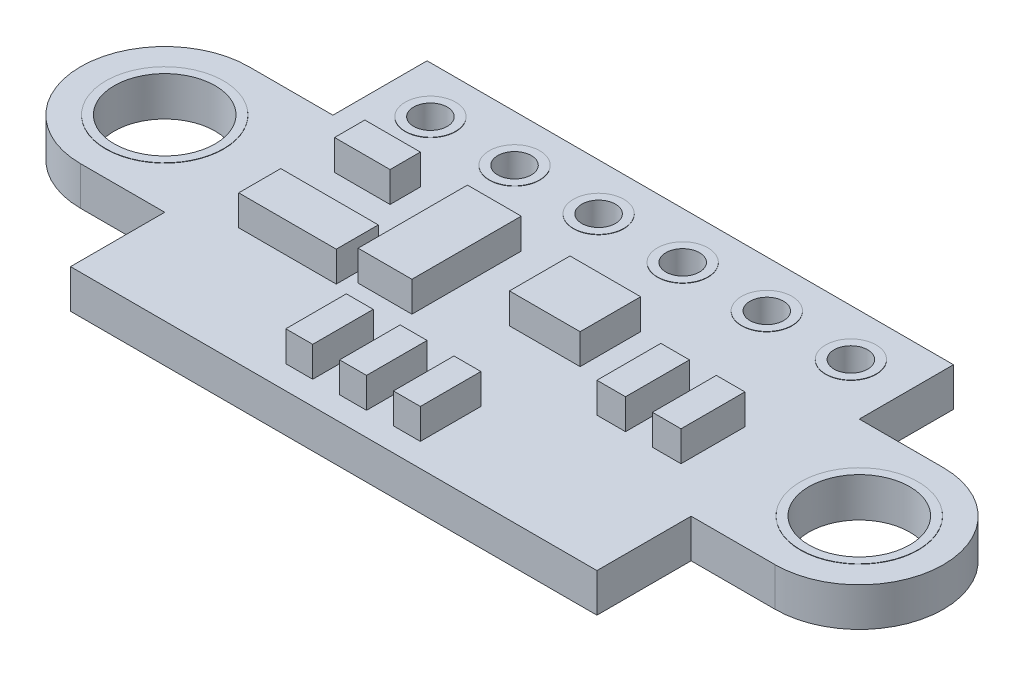
from build123d import *

# Parameters (mm, degrees)
SKETCH1_R               = 1.5
PCB_DEPTH               = 1.15
SKETCH2_R               = 0.5
INITIAL_HOLE_DEPTH      = 14.92455116
PIN_HOLE_LPATTERN_COUNT = 6
PIN_HOLE_LPATTERN_PITCH = 2.5
SKETCH4_W               = 4.4
SKETCH4_H               = 2.4
BOTTOM_COMPONENT_DEPTH  = 0.7
SKETCH3_W               = 0.8
SKETCH3_H               = 1.8
SKETCH3_W_2             = 1.65
SKETCH3_H_2             = 0.9
TAN_COMPONENTS_DEPTH    = 0.9
SKETCH3_3_W             = 2.1
SKETCH3_3_H             = 1.8
SKETCH3_3_W_2           = 1.6
SKETCH3_3_H_2           = 3.25
SKETCH3_3_W_3           = 2.9
SKETCH3_3_H_3           = 1.25
SKETCH3_3_W_4           = 0.85
SKETCH3_3_H_4           = 1.9
BLACK_COMPONENTS_DEPTH  = 0.9
GOLD_START              = -1.16
SKETCH5_R               = 0.75
SKETCH5_R_2             = 0.5
SKETCH5_R_3             = 1.75
SKETCH5_R_4             = 1.5
GOLD_CONTACTS_DEPTH     = 1.17
SILKSCREEN_DEPTH        = 0.01


with BuildPart() as part:
    # Sketch1 → PCB (new body)
    with BuildSketch(Plane(origin=(0, 0, 0), x_dir=(1, 0, 0), z_dir=(0, 1, 0))):
        with BuildLine():
            Line((-7.825, -5.3), (7.825, -5.3))
            Line((7.825, -5.3), (7.825, -2.5))
            Line((7.825, -2.5), (10.325, -2.5))
            ThreePointArc((10.325, -2.5), (12.825, 0), (10.325, 2.5))
            Line((10.325, 2.5), (7.825, 2.5))
            Line((7.825, 2.5), (7.825, 5.3))
            Line((7.825, 5.3), (-7.825, 5.3))
            Line((-7.825, 5.3), (-7.825, 2.5))
            Line((-7.825, 2.5), (-10.325, 2.5))
            ThreePointArc((-10.325, 2.5), (-12.825, 0), (-10.325, -2.5))
            Line((-10.325, -2.5), (-7.825, -2.5))
            Line((-7.825, -2.5), (-7.825, -5.3))
        make_face()
        with Locations(Location((-10.325, 0, 0), (0, 0, 270))):
            Circle(SKETCH1_R, mode=Mode.SUBTRACT)
        with Locations(Location((10.325, 0, 0), (0, 0, 270))):
            Circle(SKETCH1_R, mode=Mode.SUBTRACT)
    extrude(amount=PCB_DEPTH)

    # Sketch2 → Initial Hole (cut, through all)
    with BuildSketch(Plane(origin=(0, 1.15, 0), x_dir=(1, 0, 0), z_dir=(0, 1, 0))):
        with Locations(Location((-6.325, 3.9, 0), (0, 0, 270))):
            Circle(SKETCH2_R)
    initial_hole = extrude(amount=-INITIAL_HOLE_DEPTH, mode=Mode.SUBTRACT)

    # Pin Hole LPattern: Initial Hole ×6
    with Locations(*[(i * PIN_HOLE_LPATTERN_PITCH, 0, 0) for i in range(1, PIN_HOLE_LPATTERN_COUNT)]):
        add(initial_hole, mode=Mode.SUBTRACT)

    # Sketch4 → Bottom Component (add)
    with BuildSketch(Plane.XZ):
        with Locations((-0.125, 2.5)):
            Rectangle(SKETCH4_W, SKETCH4_H)
    extrude(amount=BOTTOM_COMPONENT_DEPTH)

    # Sketch3 → Tan Components (add)
    with BuildSketch(Plane(origin=(0, 1.15, 0), x_dir=(1, 0, 0), z_dir=(0, 1, 0))):
        with Locations((-1.725, -3.7)):
            Rectangle(SKETCH3_W, SKETCH3_H)
        with Locations((-0.125, -3.7)):
            Rectangle(SKETCH3_W, SKETCH3_H)
        with Locations((1.475, -3.7)):
            Rectangle(SKETCH3_W, SKETCH3_H)
        with Locations((-5.5, 1.5)):
            Rectangle(SKETCH3_W_2, SKETCH3_H_2)
    extrude(amount=TAN_COMPONENTS_DEPTH)

    # Sketch3<3> → Black Components (add)
    with BuildSketch(Plane(origin=(0, 1.15, 0), x_dir=(1, 0, 0), z_dir=(0, 1, 0))):
        with Locations((1.275, 0.6)):
            Rectangle(SKETCH3_3_W, SKETCH3_3_H)
        with Locations((-2.325, 0.175)):
            Rectangle(SKETCH3_3_W_2, SKETCH3_3_H_2)
        with Locations((-4.875, -1.175)):
            Rectangle(SKETCH3_3_W_3, SKETCH3_3_H_3)
        with Locations((4.25, -0.35)):
            Rectangle(SKETCH3_3_W_4, SKETCH3_3_H_4)
        with Locations((5.9, -0.35)):
            Rectangle(SKETCH3_3_W_4, SKETCH3_3_H_4)
    extrude(amount=BLACK_COMPONENTS_DEPTH)

    # Sketch5 → Gold Contacts (add)
    # profile 1 of 8: a face of its own
    with BuildSketch(Plane(origin=(0, 1.15, 0), x_dir=(1, 0, 0), z_dir=(0, 1, 0)).offset(GOLD_START)):
        with Locations(Location((-6.325, 3.9, 0), (0, 0, 90))):
            Circle(SKETCH5_R)
        with Locations(Location((-6.325, 3.9, 0), (0, 0, 270))):
            Circle(SKETCH5_R_2, mode=Mode.SUBTRACT)
    # profile 2 of 8: a face of its own
    with BuildSketch(Plane(origin=(0, 1.15, 0), x_dir=(1, 0, 0), z_dir=(0, 1, 0)).offset(GOLD_START)):
        with Locations(Location((-3.825, 3.9, 0), (0, 0, 90))):
            Circle(SKETCH5_R)
        with Locations(Location((-3.825, 3.9, 0), (0, 0, 270))):
            Circle(SKETCH5_R_2, mode=Mode.SUBTRACT)
    # profile 3 of 8: a face of its own
    with BuildSketch(Plane(origin=(0, 1.15, 0), x_dir=(1, 0, 0), z_dir=(0, 1, 0)).offset(GOLD_START)):
        with Locations(Location((-1.325, 3.9, 0), (0, 0, 90))):
            Circle(SKETCH5_R)
        with Locations(Location((-1.325, 3.9, 0), (0, 0, 270))):
            Circle(SKETCH5_R_2, mode=Mode.SUBTRACT)
    # profile 4 of 8: a face of its own
    with BuildSketch(Plane(origin=(0, 1.15, 0), x_dir=(1, 0, 0), z_dir=(0, 1, 0)).offset(GOLD_START)):
        with Locations(Location((1.175, 3.9, 0), (0, 0, 90))):
            Circle(SKETCH5_R)
        with Locations(Location((1.175, 3.9, 0), (0, 0, 270))):
            Circle(SKETCH5_R_2, mode=Mode.SUBTRACT)
    # profile 5 of 8: a face of its own
    with BuildSketch(Plane(origin=(0, 1.15, 0), x_dir=(1, 0, 0), z_dir=(0, 1, 0)).offset(GOLD_START)):
        with Locations(Location((3.675, 3.9, 0), (0, 0, 90))):
            Circle(SKETCH5_R)
        with Locations(Location((3.675, 3.9, 0), (0, 0, 270))):
            Circle(SKETCH5_R_2, mode=Mode.SUBTRACT)
    # profile 6 of 8: a face of its own
    with BuildSketch(Plane(origin=(0, 1.15, 0), x_dir=(1, 0, 0), z_dir=(0, 1, 0)).offset(GOLD_START)):
        with Locations(Location((6.175, 3.9, 0), (0, 0, 90))):
            Circle(SKETCH5_R)
        with Locations(Location((6.175, 3.9, 0), (0, 0, 270))):
            Circle(SKETCH5_R_2, mode=Mode.SUBTRACT)
    # profile 7 of 8: a face of its own
    with BuildSketch(Plane(origin=(0, 1.15, 0), x_dir=(1, 0, 0), z_dir=(0, 1, 0)).offset(GOLD_START)):
        with Locations(Location((-10.325, 0, 0), (0, 0, 90))):
            Circle(SKETCH5_R_3)
        with Locations(Location((-10.325, 0, 0), (0, 0, 90))):
            Circle(SKETCH5_R_4, mode=Mode.SUBTRACT)
    # profile 8 of 8: a face of its own
    with BuildSketch(Plane(origin=(0, 1.15, 0), x_dir=(1, 0, 0), z_dir=(0, 1, 0)).offset(GOLD_START)):
        with Locations(Location((10.325, 0, 0), (0, 0, 90))):
            Circle(SKETCH5_R_3)
        with Locations(Location((10.325, 0, 0), (0, 0, 90))):
            Circle(SKETCH5_R_4, mode=Mode.SUBTRACT)
    extrude(amount=GOLD_CONTACTS_DEPTH)

    # Sketch6 → Silkscreen (add)
    # profile 1 of 22: a face of its own
    with BuildSketch(Plane.XZ):
        Polygon((-6.825, -1.952173913), (-5.825, -2.287771739), (-5.825, -2.471195652), (-6.825, -2.807246377), (-6.825, -2.653713768), (-6.151086957, -2.43451087), (-5.953623188, -2.372463768), (-6.151086957, -2.310643116), (-6.825, -2.097327899), align=None)
    # profile 2 of 22: a face of its own
    with BuildSketch(Plane.XZ):
        Polygon((-6.709057971, -1.582608696), (-6.709057971, -1.814492754), (-6.825, -1.814492754), (-6.825, -1.205797101), (-6.709057971, -1.205797101), (-6.709057971, -1.437681159), (-5.940942029, -1.437681159), (-5.940942029, -1.205797101), (-5.825, -1.205797101), (-5.825, -1.814492754), (-5.940942029, -1.814492754), (-5.940942029, -1.582608696), align=None)
    # profile 3 of 22: a face of its own
    with BuildSketch(Plane.XZ):
        Polygon((-5.825, -0.32173913), (-5.825, -0.513088768), (-6.450226449, -0.780751812), (-6.651086957, -0.857971014), (-6.145652174, -0.857971014), (-5.825, -0.857971014), (-5.825, -1.002898551), (-6.825, -1.002898551), (-6.825, -0.813813406), (-6.229438406, -0.558831522), (-5.998913043, -0.466666667), (-6.538768116, -0.466666667), (-6.825, -0.466666667), (-6.825, -0.32173913), align=None)
    # profile 4 of 22: a face of its own
    with BuildSketch(Plane.XZ):
        with BuildLine():
            add(Edge.make_bspline(
                [(-4.16557971, -2.017391304), (-4.174136808, -2.036630775), (-4.191199813, -2.074994622), (-4.206514485, -2.125407709), (-4.215359186, -2.166891843), (-4.220047282, -2.199419822), (-4.223108769, -2.233289439), (-4.22340197, -2.25636393), (-4.223550725, -2.268070652)],
                knots=[0, 0, 0, 0, 1.45945927, 2.910187841, 3.643322816, 4.400006487, 5.188251666, 6, 6, 6, 6], degree=3))
            add(Edge.make_bspline(
                [(-4.223550725, -2.268070652), (-4.22322949, -2.281377316), (-4.222602438, -2.307351996), (-4.216940861, -2.345108655), (-4.208337016, -2.380758222), (-4.195489198, -2.413866615), (-4.17961186, -2.44462082), (-4.160629453, -2.472899107), (-4.138904749, -2.498868644), (-4.113944215, -2.522077592), (-4.086253856, -2.542779138), (-4.055632763, -2.560551871), (-4.022719242, -2.576378917), (-3.987082881, -2.589094015), (-3.949265216, -2.599443979), (-3.909263191, -2.606099476), (-3.867467195, -2.611013366), (-3.838904478, -2.611397876), (-3.824320652, -2.611594203)],
                knots=[0, 0, 0, 0, 1.073506903, 2.095491357, 3.07528147, 4.02808022, 4.954664346, 5.863855779, 6.771964439, 7.68156413, 8.60894928, 9.556766833, 10.535210833, 11.552936014, 12.60679191, 13.695699548, 14.823448183, 16, 16, 16, 16], degree=3))
            add(Edge.make_bspline(
                [(-3.824320652, -2.611594203), (-3.809143177, -2.611380344), (-3.779578644, -2.610963765), (-3.736449664, -2.607633153), (-3.695878247, -2.601633568), (-3.657629955, -2.593961819), (-3.622081106, -2.583343084), (-3.589249985, -2.570170376), (-3.55912608, -2.554625403), (-3.531963675, -2.536090261), (-3.507539876, -2.515047996), (-3.486319521, -2.490985639), (-3.468092374, -2.464275607), (-3.452820225, -2.434812166), (-3.44069766, -2.402464295), (-3.432593727, -2.36704555), (-3.427130416, -2.328777955), (-3.426681667, -2.302209832), (-3.426449275, -2.288451087)],
                knots=[0, 0, 0, 0, 1.243083075, 2.421428388, 3.539723701, 4.600698439, 5.613925084, 6.573719655, 7.494592113, 8.384583086, 9.261071518, 10.128265192, 11.004557353, 11.903267233, 12.840351451, 13.825576228, 14.873938418, 16, 16, 16, 16], degree=3))
            add(Edge.make_bspline(
                [(-3.426449275, -2.288451087), (-3.426557797, -2.283391816), (-3.426783167, -2.272885048), (-3.427977385, -2.256723311), (-3.429688391, -2.240016095), (-3.432332267, -2.223210614), (-3.434998211, -2.206580775), (-3.439049004, -2.190736952), (-3.442817527, -2.175890096), (-3.446156732, -2.1666755), (-3.447735507, -2.162318841)],
                knots=[0, 0, 0, 0, 0.945174182, 1.962876632, 3.026435683, 4.081359978, 5.140798144, 6.170252855, 7.134895744, 8, 8, 8, 8], degree=3))
            Line((-3.447735507, -2.162318841), (-3.774275362, -2.162318841))
            Line((-3.774275362, -2.162318841), (-3.774275362, -2.363405797))
            Line((-3.774275362, -2.363405797), (-3.890217391, -2.363405797))
            Line((-3.890217391, -2.363405797), (-3.890217391, -2.017391304))
            Line((-3.890217391, -2.017391304), (-3.371875, -2.017391304))
            add(Edge.make_bspline(
                [(-3.371875, -2.017391304), (-3.367030046, -2.028271125), (-3.357200328, -2.050344726), (-3.345363234, -2.08510047), (-3.334241057, -2.120769039), (-3.325959411, -2.157567213), (-3.31869163, -2.19443818), (-3.31419718, -2.231229109), (-3.310988457, -2.267183443), (-3.310665771, -2.290859659), (-3.310507246, -2.302490942)],
                knots=[0, 0, 0, 0, 0.972500234, 1.973063936, 2.997292887, 4.023432248, 5.052698482, 6.066196364, 7.049990992, 8, 8, 8, 8], degree=3))
            add(Edge.make_bspline(
                [(-3.310507246, -2.302490942), (-3.310905816, -2.319565756), (-3.311684267, -2.35291475), (-3.317554741, -2.401697579), (-3.327799519, -2.447761658), (-3.341765997, -2.491305823), (-3.359867574, -2.531840385), (-3.381832828, -2.569470393), (-3.407650288, -2.603973416), (-3.437529203, -2.635228568), (-3.471387186, -2.662948247), (-3.508911649, -2.687650368), (-3.550729527, -2.708302897), (-3.596038452, -2.726063283), (-3.645257849, -2.739888456), (-3.698190574, -2.749395276), (-3.754813701, -2.755404218), (-3.793809632, -2.756141713), (-3.813903986, -2.756521739)],
                knots=[0, 0, 0, 0, 1.063581333, 2.077291621, 3.055048503, 3.999338437, 4.921305722, 5.814907333, 6.708360461, 7.599707407, 8.501634143, 9.428958272, 10.392121034, 11.401590661, 12.45703254, 13.571190175, 14.748449862, 16, 16, 16, 16], degree=3))
            add(Edge.make_bspline(
                [(-3.813903986, -2.756521739), (-3.833924869, -2.756086904), (-3.873021503, -2.75523776), (-3.930089405, -2.748620154), (-3.983972025, -2.737560692), (-4.034559078, -2.722216618), (-4.081689195, -2.702747531), (-4.124974269, -2.679239878), (-4.165055349, -2.652836335), (-4.200910799, -2.622257515), (-4.232998202, -2.588436343), (-4.261036494, -2.551292568), (-4.284869344, -2.510889075), (-4.304888067, -2.467540256), (-4.320451722, -2.421293126), (-4.331540229, -2.372516514), (-4.338177251, -2.321469625), (-4.339049616, -2.286659206), (-4.339492754, -2.268976449)],
                knots=[0, 0, 0, 0, 1.187439749, 2.318823544, 3.40248674, 4.446409754, 5.450107936, 6.421783, 7.364382464, 8.292037633, 9.210592067, 10.124945974, 11.046464198, 11.988116631, 12.952407463, 13.935437336, 14.951257712, 16, 16, 16, 16], degree=3))
            add(Edge.make_bspline(
                [(-4.339492754, -2.268976449), (-4.338967559, -2.246458731), (-4.337940426, -2.202420402), (-4.331256424, -2.14819149), (-4.323600483, -2.106385649), (-4.315620928, -2.076129681), (-4.307099293, -2.0462542), (-4.299706484, -2.027004609), (-4.296014493, -2.017391304)],
                knots=[0, 0, 0, 0, 1.577988587, 3.086102288, 3.823904134, 4.555361188, 5.278542922, 6, 6, 6, 6], degree=3))
            Line((-4.296014493, -2.017391304), (-4.16557971, -2.017391304))
        make_face()
    # profile 5 of 22: a face of its own
    with BuildSketch(Plane.XZ):
        Polygon((-3.325, -1.176811594), (-3.325, -1.368161232), (-3.950226449, -1.635824275), (-4.151086957, -1.713043478), (-3.645652174, -1.713043478), (-3.325, -1.713043478), (-3.325, -1.857971014), (-4.325, -1.857971014), (-4.325, -1.66888587), (-3.729438406, -1.413903986), (-3.498913043, -1.32173913), (-4.038768116, -1.32173913), (-4.325, -1.32173913), (-4.325, -1.176811594), align=None)
    # profile 6 of 22: a face of its own
    with BuildSketch(Plane.XZ):
        with BuildLine():
            add(Edge.make_bspline(
                [(-3.836096014, -0.27826087), (-3.812594171, -0.278737134), (-3.766491769, -0.279671398), (-3.709766433, -0.286970746), (-3.666180263, -0.295280938), (-3.634972547, -0.303483854), (-3.604849033, -0.313234061), (-3.575958638, -0.324751193), (-3.548183732, -0.337951756), (-3.52159763, -0.352747386), (-3.496713015, -0.369994169), (-3.472761853, -0.388505681), (-3.450235426, -0.409094524), (-3.429589218, -0.432168545), (-3.410505814, -0.457341518), (-3.393246465, -0.48485945), (-3.377997913, -0.514659864), (-3.363881117, -0.546402566), (-3.352650459, -0.580813238), (-3.342514641, -0.617323563), (-3.33463535, -0.656364207), (-3.329042087, -0.697964541), (-3.325608517, -0.742121998), (-3.325206339, -0.772442291), (-3.325, -0.787998188)],
                knots=[0, 0, 0, 0, 1.874778086, 3.677659276, 4.555411841, 5.414508245, 6.25076779, 7.080755626, 7.894473888, 8.703653385, 9.505626019, 10.308141413, 11.118150068, 11.937068997, 12.775581797, 13.636302782, 14.525391725, 15.445290438, 16.405354875, 17.410742648, 18.46805968, 19.580643525, 20.758743499, 22, 22, 22, 22], degree=3))
            Line((-3.325, -0.787998188), (-3.325, -1.002898551))
            Line((-3.325, -1.002898551), (-4.325, -1.002898551))
            Line((-4.325, -1.002898551), (-4.325, -0.744293478))
            add(Edge.make_bspline(
                [(-4.325, -0.744293478), (-4.324688368, -0.725333018), (-4.324083472, -0.688529625), (-4.318395518, -0.635197923), (-4.30890193, -0.585590009), (-4.295955445, -0.539604937), (-4.278839084, -0.497440889), (-4.258296007, -0.45883863), (-4.233600376, -0.424093617), (-4.205072566, -0.393057329), (-4.172712538, -0.365663685), (-4.136222346, -0.342239325), (-4.095907101, -0.322258215), (-4.051566132, -0.305974266), (-4.003189722, -0.293682427), (-3.951029965, -0.284699007), (-3.894863296, -0.279213265), (-3.856111855, -0.278585251), (-3.836096014, -0.27826087)],
                knots=[0, 0, 0, 0, 1.17177347, 2.274482801, 3.310388109, 4.291013938, 5.222472681, 6.118087065, 6.988127256, 7.850034114, 8.717518086, 9.601485366, 10.523818561, 11.493740021, 12.515690363, 13.604990885, 14.762933224, 16, 16, 16, 16], degree=3))
        make_face()
        with BuildLine():
            add(Edge.make_bspline(
                [(-3.824547101, -0.423188406), (-3.841612899, -0.423371822), (-3.874427817, -0.423724502), (-3.921550288, -0.427329088), (-3.964611557, -0.43335622), (-4.003740235, -0.441819199), (-4.039012488, -0.452994776), (-4.070937402, -0.466111822), (-4.09887287, -0.482673258), (-4.123789391, -0.50122703), (-4.144883235, -0.522800987), (-4.163203552, -0.546604149), (-4.177741542, -0.573323206), (-4.18966826, -0.60231497), (-4.198346963, -0.633909563), (-4.204715068, -0.667986445), (-4.208204125, -0.704743636), (-4.208767587, -0.730095831), (-4.209057971, -0.743161232)],
                knots=[0, 0, 0, 0, 1.413273786, 2.717509377, 3.911113665, 5.012370192, 6.028682814, 6.972739505, 7.863782455, 8.711554031, 9.53824734, 10.354760011, 11.191533455, 12.049501983, 12.946054968, 13.900037449, 14.917772052, 16, 16, 16, 16], degree=3))
            Line((-4.209057971, -0.743161232), (-4.209057971, -0.857971014))
            Line((-4.209057971, -0.857971014), (-3.440942029, -0.857971014))
            Line((-3.440942029, -0.857971014), (-3.440942029, -0.758106884))
            add(Edge.make_bspline(
                [(-3.440942029, -0.758106884), (-3.441280588, -0.744586824), (-3.441938681, -0.718306405), (-3.446036804, -0.68011771), (-3.453866258, -0.644687488), (-3.464227658, -0.611790195), (-3.47752298, -0.581425169), (-3.494259025, -0.553832382), (-3.513777188, -0.528726818), (-3.536487171, -0.5063141), (-3.562196806, -0.486545875), (-3.591014635, -0.469554942), (-3.622633627, -0.455009878), (-3.657253549, -0.443271608), (-3.694873433, -0.434308497), (-3.735437992, -0.427783479), (-3.779033431, -0.423973079), (-3.809065455, -0.423455315), (-3.824547101, -0.423188406)],
                knots=[0, 0, 0, 0, 1.112368836, 2.162232858, 3.153671654, 4.092370021, 4.995862172, 5.873374016, 6.740409183, 7.605418486, 8.490978658, 9.401506614, 10.351738463, 11.349303293, 12.403565438, 13.529577563, 14.726485918, 16, 16, 16, 16], degree=3))
        make_face(mode=Mode.SUBTRACT)
    # profile 7 of 22: a face of its own
    with BuildSketch(Plane.XZ):
        with BuildLine():
            add(Edge.make_bspline(
                [(-1.095606884, -2.031884058), (-1.084037243, -2.032217236), (-1.061517869, -2.032865741), (-1.02883408, -2.038329271), (-0.998514455, -2.04769559), (-0.970339585, -2.060464718), (-0.944570102, -2.076602975), (-0.920890583, -2.095645384), (-0.899597744, -2.117634909), (-0.880775705, -2.142642667), (-0.863875018, -2.170070441), (-0.84972659, -2.200494312), (-0.837484548, -2.233341893), (-0.827584942, -2.268731992), (-0.82003006, -2.306373014), (-0.814277248, -2.345969656), (-0.811208625, -2.387511393), (-0.810744152, -2.415786545), (-0.810507246, -2.430208333)],
                knots=[0, 0, 0, 0, 1.005542668, 1.957207907, 2.870649987, 3.757654935, 4.639106304, 5.50728757, 6.393806754, 7.292990278, 8.223879093, 9.189763998, 10.205281347, 11.269088171, 12.381198635, 13.541420952, 14.745997712, 16, 16, 16, 16], degree=3))
            add(Edge.make_bspline(
                [(-0.810507246, -2.430208333), (-0.810622933, -2.443496977), (-0.810853786, -2.470014301), (-0.813166181, -2.509408285), (-0.815673861, -2.548009533), (-0.819456641, -2.585126407), (-0.823303967, -2.620585883), (-0.828456035, -2.653751594), (-0.833398889, -2.684469288), (-0.837531778, -2.703848445), (-0.839492754, -2.713043478)],
                knots=[0, 0, 0, 0, 1.119774364, 2.234495903, 3.324975685, 4.379535058, 5.378502437, 6.330339078, 7.20777842, 8, 8, 8, 8], degree=3))
            Line((-0.839492754, -2.713043478), (-0.969927536, -2.713043478))
            add(Edge.make_bspline(
                [(-0.969927536, -2.713043478), (-0.966552908, -2.703194299), (-0.959657693, -2.683069944), (-0.951570232, -2.651503019), (-0.943974855, -2.618390348), (-0.937629391, -2.583417285), (-0.9326352, -2.546243106), (-0.929122846, -2.50672598), (-0.926744308, -2.464733157), (-0.926549451, -2.435948546), (-0.926449275, -2.421150362)],
                knots=[0, 0, 0, 0, 0.842364813, 1.72116351, 2.635659137, 3.591954833, 4.596841017, 5.670471508, 6.802388115, 8, 8, 8, 8], degree=3))
            add(Edge.make_bspline(
                [(-0.926449275, -2.421150362), (-0.92655811, -2.410577772), (-0.92676745, -2.390241856), (-0.928956044, -2.360938837), (-0.931809416, -2.334030456), (-0.936765492, -2.309574695), (-0.942469956, -2.28732606), (-0.949729155, -2.267216224), (-0.958367794, -2.249276352), (-0.968052863, -2.233195397), (-0.97924044, -2.219408765), (-0.991306366, -2.207338701), (-1.004787784, -2.197552637), (-1.019410561, -2.189872313), (-1.03498124, -2.183872496), (-1.051666285, -2.179898308), (-1.069411035, -2.177339563), (-1.08163324, -2.176990691), (-1.087907609, -2.176811594)],
                knots=[0, 0, 0, 0, 1.523249472, 2.929903915, 4.233296251, 5.419431577, 6.522341058, 7.540917397, 8.494515215, 9.388156094, 10.239274487, 11.04695073, 11.841108735, 12.62943441, 13.421354294, 14.239221521, 15.096090076, 16, 16, 16, 16], degree=3))
            add(Edge.make_bspline(
                [(-1.087907609, -2.176811594), (-1.094426537, -2.17703645), (-1.107163151, -2.177475772), (-1.125435736, -2.181963136), (-1.142380665, -2.188979105), (-1.15749305, -2.199264852), (-1.171692263, -2.211352456), (-1.184703873, -2.225552355), (-1.197283356, -2.241228157), (-1.213115965, -2.265007733), (-1.231630292, -2.298354985), (-1.250637426, -2.342511497), (-1.26886559, -2.38970772), (-1.288476693, -2.437864455), (-1.309006891, -2.486204671), (-1.331340416, -2.533292462), (-1.355979832, -2.578017492), (-1.381319557, -2.61105989), (-1.403463962, -2.634677033), (-1.421459789, -2.650462776), (-1.44109508, -2.664186822), (-1.461836158, -2.676643308), (-1.484550157, -2.686519849), (-1.509153672, -2.693424444), (-1.53573621, -2.697919666), (-1.554147254, -2.698335482), (-1.563677536, -2.698550725)],
                knots=[0, 0, 0, 0, 0.619856703, 1.211069627, 1.781317632, 2.357652662, 2.944124569, 3.554568585, 4.189016027, 4.857081954, 6.273378886, 7.815244584, 9.432151164, 11.09313998, 12.767999346, 14.433898664, 16.057028127, 17.6216601, 18.384562662, 19.138741378, 19.896851429, 20.66387654, 21.439947467, 22.247841025, 23.093013471, 24, 24, 24, 24], degree=3))
            add(Edge.make_bspline(
                [(-1.563677536, -2.698550725), (-1.572223552, -2.698290907), (-1.589336579, -2.697770634), (-1.614907555, -2.693472972), (-1.640254816, -2.686713531), (-1.665287559, -2.677198511), (-1.689421117, -2.664730656), (-1.712573795, -2.649573358), (-1.733868511, -2.630857975), (-1.7541838, -2.60963982), (-1.772586237, -2.58489951), (-1.789061309, -2.557014122), (-1.803511537, -2.525836375), (-1.816546422, -2.491668648), (-1.82691831, -2.453932463), (-1.83434214, -2.412792808), (-1.838533807, -2.368248169), (-1.839165775, -2.337448397), (-1.839492754, -2.321512681)],
                knots=[0, 0, 0, 0, 0.784008501, 1.569943279, 2.373275585, 3.189059721, 4.022597455, 4.862331727, 5.722035901, 6.618905113, 7.554234865, 8.545209567, 9.586587379, 10.704826919, 11.898277364, 13.172984207, 14.537309982, 16, 16, 16, 16], degree=3))
            add(Edge.make_bspline(
                [(-1.839492754, -2.321512681), (-1.839317368, -2.312604062), (-1.838952995, -2.2940959), (-1.837368927, -2.265541429), (-1.834647801, -2.235792618), (-1.830979071, -2.205529197), (-1.826738506, -2.175318782), (-1.821753302, -2.14565927), (-1.816429126, -2.117187582), (-1.812435233, -2.098753719), (-1.810507246, -2.089855072)],
                knots=[0, 0, 0, 0, 0.914358742, 1.899632051, 2.934074914, 3.979452354, 5.027838988, 6.06445484, 7.065647236, 8, 8, 8, 8], degree=3))
            Line((-1.810507246, -2.089855072), (-1.694565217, -2.089855072))
            add(Edge.make_bspline(
                [(-1.694565217, -2.089855072), (-1.698925606, -2.109666509), (-1.707605604, -2.149104107), (-1.716805547, -2.208363865), (-1.722438512, -2.266677422), (-1.723184374, -2.30512101), (-1.723550725, -2.324003623)],
                knots=[0, 0, 0, 0, 1.029354975, 2.049083439, 3.041754323, 4, 4, 4, 4], degree=3))
            add(Edge.make_bspline(
                [(-1.723550725, -2.324003623), (-1.723405312, -2.333516863), (-1.723123445, -2.351957249), (-1.721390441, -2.37865386), (-1.718216986, -2.403372901), (-1.7139249, -2.426139484), (-1.70861338, -2.447016528), (-1.701865324, -2.465939781), (-1.693628433, -2.482804989), (-1.684373765, -2.497895917), (-1.673896999, -2.510991), (-1.662774558, -2.522502654), (-1.650680114, -2.532113634), (-1.637615824, -2.539871733), (-1.623755385, -2.545943065), (-1.609156755, -2.550658199), (-1.593572125, -2.553051309), (-1.582932509, -2.553429675), (-1.577490942, -2.553623188)],
                knots=[0, 0, 0, 0, 1.491437277, 2.890989782, 4.191431573, 5.395946596, 6.521058188, 7.565423013, 8.539223212, 9.458660202, 10.334655275, 11.163081303, 11.963306063, 12.748694206, 13.538083787, 14.331542868, 15.146677777, 16, 16, 16, 16], degree=3))
            add(Edge.make_bspline(
                [(-1.577490942, -2.553623188), (-1.570971784, -2.553399859), (-1.55823472, -2.552963522), (-1.5398974, -2.548438055), (-1.522919275, -2.541474541), (-1.507500113, -2.531386016), (-1.493419772, -2.519066768), (-1.479923473, -2.505133221), (-1.467231268, -2.489422296), (-1.451018729, -2.465673216), (-1.432444857, -2.432169319), (-1.413455089, -2.387874166), (-1.394889723, -2.340779741), (-1.375339262, -2.292569889), (-1.354853968, -2.244174305), (-1.335835518, -2.204717583), (-1.319501928, -2.17409803), (-1.30581027, -2.15264009), (-1.291370605, -2.132264668), (-1.275414854, -2.113533564), (-1.258550452, -2.095940414), (-1.240018277, -2.080309313), (-1.220378755, -2.066150977), (-1.199065245, -2.054076214), (-1.176151406, -2.043837011), (-1.151019267, -2.037035783), (-1.124001456, -2.032509701), (-1.10528886, -2.03209739), (-1.095606884, -2.031884058)],
                knots=[0, 0, 0, 0, 0.667490157, 1.304135379, 1.925338702, 2.541746512, 3.184203398, 3.84128389, 4.529338779, 5.253104542, 6.788775438, 8.449127214, 10.193159048, 11.981788067, 13.78535353, 15.582625783, 16.473069092, 17.343045967, 18.191816017, 19.032495598, 19.864754018, 20.688614347, 21.515778917, 22.344572585, 23.197569954, 24.082441501, 25.007847132, 26, 26, 26, 26], degree=3))
        make_face()
    # profile 8 of 22: a face of its own
    with BuildSketch(Plane.XZ):
        with BuildLine():
            add(Edge.make_bspline(
                [(-0.853985507, -1.191304348), (-0.847265054, -1.211198667), (-0.833858192, -1.250886523), (-0.820502545, -1.312589005), (-0.812044566, -1.375547052), (-0.811021461, -1.418103693), (-0.810507246, -1.439492754)],
                knots=[0, 0, 0, 0, 0.994474773, 1.983911717, 2.986709619, 4, 4, 4, 4], degree=3))
            add(Edge.make_bspline(
                [(-0.810507246, -1.439492754), (-0.810901207, -1.456417224), (-0.811668769, -1.489391568), (-0.81754297, -1.537334119), (-0.827551451, -1.582205593), (-0.841218668, -1.624256749), (-0.859507278, -1.663032142), (-0.881338394, -1.69901549), (-0.907309797, -1.731840445), (-0.937447752, -1.761377351), (-0.971279054, -1.787754026), (-1.009086081, -1.810543748), (-1.050637644, -1.829770601), (-1.096089466, -1.845247582), (-1.145099789, -1.857865696), (-1.19803705, -1.866127952), (-1.254690314, -1.871481194), (-1.293736763, -1.872129119), (-1.313903986, -1.872463768)],
                knots=[0, 0, 0, 0, 1.072461845, 2.089502642, 3.055154834, 3.982506854, 4.885653992, 5.766011576, 6.644638719, 7.530942326, 8.434292162, 9.357290509, 10.322575283, 11.330177533, 12.396475876, 13.525855063, 14.722121131, 16, 16, 16, 16], degree=3))
            add(Edge.make_bspline(
                [(-1.313903986, -1.872463768), (-1.333541802, -1.872046818), (-1.371919636, -1.87123198), (-1.428125246, -1.865615079), (-1.481386529, -1.85580605), (-1.531791789, -1.842681738), (-1.578680738, -1.825346283), (-1.622235705, -1.80504693), (-1.66199991, -1.781216428), (-1.698049149, -1.754188874), (-1.730184027, -1.723819803), (-1.758645531, -1.690500807), (-1.78297031, -1.653943996), (-1.803450326, -1.614674149), (-1.819634828, -1.57252485), (-1.83099783, -1.527831802), (-1.838351232, -1.480722439), (-1.839106398, -1.448503605), (-1.839492754, -1.432019928)],
                knots=[0, 0, 0, 0, 1.219583202, 2.383409664, 3.503355981, 4.580195591, 5.613927346, 6.60373989, 7.560461434, 8.487729334, 9.396383554, 10.300965463, 11.203297331, 12.117485303, 13.046422561, 14.000383661, 14.976963838, 16, 16, 16, 16], degree=3))
            add(Edge.make_bspline(
                [(-1.839492754, -1.432019928), (-1.839374098, -1.420768898), (-1.839140568, -1.398625381), (-1.836951594, -1.366079387), (-1.834002252, -1.334751992), (-1.827485834, -1.294938294), (-1.816584324, -1.246581538), (-1.802847935, -1.209667817), (-1.796014493, -1.191304348)],
                knots=[0, 0, 0, 0, 0.82263702, 1.61905864, 2.384719601, 3.122514214, 4.568537041, 6, 6, 6, 6], degree=3))
            Line((-1.796014493, -1.191304348), (-1.66557971, -1.191304348))
            add(Edge.make_bspline(
                [(-1.66557971, -1.191304348), (-1.67014263, -1.200234343), (-1.679184809, -1.217930601), (-1.690813612, -1.245400499), (-1.700619737, -1.273350942), (-1.709290954, -1.30182182), (-1.715450709, -1.33125284), (-1.720385378, -1.361755051), (-1.723022277, -1.39362752), (-1.723372729, -1.415333944), (-1.723550725, -1.426358696)],
                knots=[0, 0, 0, 0, 0.983555818, 1.94907818, 2.92339169, 3.888715259, 4.866203398, 5.870584672, 6.918464223, 8, 8, 8, 8], degree=3))
            add(Edge.make_bspline(
                [(-1.723550725, -1.426358696), (-1.723308335, -1.437630288), (-1.722833794, -1.459697356), (-1.71726705, -1.491923246), (-1.70910268, -1.522621867), (-1.697148519, -1.551521546), (-1.682298043, -1.578642811), (-1.663831601, -1.603366367), (-1.643035491, -1.626525261), (-1.618792522, -1.6471198), (-1.591687156, -1.665565159), (-1.561592242, -1.681523099), (-1.528948792, -1.695681528), (-1.493342612, -1.707118464), (-1.455147418, -1.716429231), (-1.414251783, -1.722892673), (-1.370817664, -1.726754837), (-1.341010647, -1.72727083), (-1.325679348, -1.727536232)],
                knots=[0, 0, 0, 0, 0.961321688, 1.882036724, 2.784158746, 3.668588788, 4.54556749, 5.416939704, 6.297416125, 7.197763834, 8.125489491, 9.091444601, 10.101847706, 11.159586289, 12.280336908, 13.455344771, 14.691151478, 16, 16, 16, 16], degree=3))
            add(Edge.make_bspline(
                [(-1.325679348, -1.727536232), (-1.309669946, -1.727349541), (-1.278663797, -1.72698797), (-1.233657513, -1.723338585), (-1.191687563, -1.717240514), (-1.152652909, -1.709016935), (-1.116693585, -1.698213284), (-1.083904011, -1.684773943), (-1.053977905, -1.669187417), (-1.027143609, -1.651040272), (-1.003308302, -1.630481199), (-0.982636226, -1.607615562), (-0.965216889, -1.582299822), (-0.950883725, -1.554884447), (-0.940055192, -1.525060397), (-0.932116639, -1.493200522), (-0.927296399, -1.459038371), (-0.926736851, -1.435508094), (-0.926449275, -1.423414855)],
                knots=[0, 0, 0, 0, 1.344764027, 2.604466577, 3.790065809, 4.905748876, 5.95291627, 6.939762846, 7.878684932, 8.782738285, 9.654914262, 10.51702678, 11.364887745, 12.22998046, 13.108770886, 14.023899159, 14.984395335, 16, 16, 16, 16], degree=3))
            add(Edge.make_bspline(
                [(-0.926449275, -1.423414855), (-0.926597601, -1.412990176), (-0.926891639, -1.392324569), (-0.930024622, -1.36170696), (-0.934638715, -1.331716693), (-0.941597766, -1.302433621), (-0.949991962, -1.273742021), (-0.959625863, -1.245518646), (-0.971293022, -1.218094173), (-0.980037468, -1.200248709), (-0.98442029, -1.191304348)],
                knots=[0, 0, 0, 0, 1.035533676, 2.052814528, 3.055360482, 4.048773743, 5.04096863, 6.025393086, 7.010303204, 8, 8, 8, 8], degree=3))
            Line((-0.98442029, -1.191304348), (-0.853985507, -1.191304348))
        make_face()
    # profile 9 of 22: a face of its own
    with BuildSketch(Plane.XZ):
        Polygon((-0.825, -0.336231884), (-0.825, -0.915942029), (-1.825, -0.915942029), (-1.825, -0.771014493), (-0.940942029, -0.771014493), (-0.940942029, -0.336231884), align=None)
    # profile 10 of 22: a face of its own
    with BuildSketch(Plane.XZ):
        with BuildLine():
            add(Edge.make_bspline(
                [(1.404393116, -2.031884058), (1.415962757, -2.032217236), (1.438482131, -2.032865741), (1.47116592, -2.038329271), (1.501485545, -2.04769559), (1.529660415, -2.060464718), (1.555429898, -2.076602975), (1.579109417, -2.095645384), (1.600402256, -2.117634909), (1.619224295, -2.142642667), (1.636124982, -2.170070441), (1.65027341, -2.200494312), (1.662515452, -2.233341893), (1.672415058, -2.268731992), (1.67996994, -2.306373014), (1.685722752, -2.345969656), (1.688791375, -2.387511393), (1.689255848, -2.415786545), (1.689492754, -2.430208333)],
                knots=[0, 0, 0, 0, 1.005542668, 1.957207907, 2.870649987, 3.757654935, 4.639106304, 5.50728757, 6.393806754, 7.292990278, 8.223879093, 9.189763998, 10.205281347, 11.269088171, 12.381198635, 13.541420952, 14.745997712, 16, 16, 16, 16], degree=3))
            add(Edge.make_bspline(
                [(1.689492754, -2.430208333), (1.689377067, -2.443496977), (1.689146214, -2.470014301), (1.686833819, -2.509408285), (1.684326139, -2.548009533), (1.680543359, -2.585126407), (1.676696033, -2.620585883), (1.671543965, -2.653751594), (1.666601111, -2.684469288), (1.662468222, -2.703848445), (1.660507246, -2.713043478)],
                knots=[0, 0, 0, 0, 1.119774364, 2.234495903, 3.324975685, 4.379535058, 5.378502437, 6.330339078, 7.20777842, 8, 8, 8, 8], degree=3))
            Line((1.660507246, -2.713043478), (1.530072464, -2.713043478))
            add(Edge.make_bspline(
                [(1.530072464, -2.713043478), (1.533447092, -2.703194299), (1.540342307, -2.683069944), (1.548429768, -2.651503019), (1.556025145, -2.618390348), (1.562370609, -2.583417285), (1.5673648, -2.546243106), (1.570877154, -2.50672598), (1.573255692, -2.464733157), (1.573450549, -2.435948546), (1.573550725, -2.421150362)],
                knots=[0, 0, 0, 0, 0.842364813, 1.72116351, 2.635659137, 3.591954833, 4.596841017, 5.670471508, 6.802388115, 8, 8, 8, 8], degree=3))
            add(Edge.make_bspline(
                [(1.573550725, -2.421150362), (1.57344189, -2.410577772), (1.57323255, -2.390241856), (1.571043956, -2.360938837), (1.568190584, -2.334030456), (1.563234508, -2.309574695), (1.557530044, -2.28732606), (1.550270845, -2.267216224), (1.541632206, -2.249276352), (1.531947137, -2.233195397), (1.52075956, -2.219408765), (1.508693634, -2.207338701), (1.495212216, -2.197552637), (1.480589439, -2.189872313), (1.46501876, -2.183872496), (1.448333715, -2.179898308), (1.430588965, -2.177339563), (1.41836676, -2.176990691), (1.412092391, -2.176811594)],
                knots=[0, 0, 0, 0, 1.523249472, 2.929903915, 4.233296251, 5.419431577, 6.522341058, 7.540917397, 8.494515215, 9.388156094, 10.239274487, 11.04695073, 11.841108735, 12.62943441, 13.421354294, 14.239221521, 15.096090076, 16, 16, 16, 16], degree=3))
            add(Edge.make_bspline(
                [(1.412092391, -2.176811594), (1.405573463, -2.17703645), (1.392836849, -2.177475772), (1.374564264, -2.181963136), (1.357619335, -2.188979105), (1.34250695, -2.199264852), (1.328307737, -2.211352456), (1.315296127, -2.225552355), (1.302716644, -2.241228157), (1.286884035, -2.265007733), (1.268369708, -2.298354985), (1.249362574, -2.342511497), (1.23113441, -2.38970772), (1.211523307, -2.437864455), (1.190993109, -2.486204671), (1.168659584, -2.533292462), (1.144020168, -2.578017492), (1.118680443, -2.61105989), (1.096536038, -2.634677033), (1.078540211, -2.650462776), (1.05890492, -2.664186822), (1.038163842, -2.676643308), (1.015449843, -2.686519849), (0.990846328, -2.693424444), (0.96426379, -2.697919666), (0.945852746, -2.698335482), (0.936322464, -2.698550725)],
                knots=[0, 0, 0, 0, 0.619856703, 1.211069627, 1.781317632, 2.357652662, 2.944124569, 3.554568585, 4.189016027, 4.857081954, 6.273378886, 7.815244584, 9.432151164, 11.09313998, 12.767999346, 14.433898664, 16.057028127, 17.6216601, 18.384562662, 19.138741378, 19.896851429, 20.66387654, 21.439947467, 22.247841025, 23.093013471, 24, 24, 24, 24], degree=3))
            add(Edge.make_bspline(
                [(0.936322464, -2.698550725), (0.927776448, -2.698290907), (0.910663421, -2.697770634), (0.885092445, -2.693472972), (0.859745184, -2.686713531), (0.834712441, -2.677198511), (0.810578883, -2.664730656), (0.787426205, -2.649573358), (0.766131489, -2.630857975), (0.7458162, -2.60963982), (0.727413763, -2.58489951), (0.710938691, -2.557014122), (0.696488463, -2.525836375), (0.683453578, -2.491668648), (0.67308169, -2.453932463), (0.66565786, -2.412792808), (0.661466193, -2.368248169), (0.660834225, -2.337448397), (0.660507246, -2.321512681)],
                knots=[0, 0, 0, 0, 0.784008501, 1.569943279, 2.373275585, 3.189059721, 4.022597455, 4.862331727, 5.722035901, 6.618905113, 7.554234865, 8.545209567, 9.586587379, 10.704826919, 11.898277364, 13.172984207, 14.537309982, 16, 16, 16, 16], degree=3))
            add(Edge.make_bspline(
                [(0.660507246, -2.321512681), (0.660682632, -2.312604062), (0.661047005, -2.2940959), (0.662631073, -2.265541429), (0.665352199, -2.235792618), (0.669020929, -2.205529197), (0.673261494, -2.175318782), (0.678246698, -2.14565927), (0.683570874, -2.117187582), (0.687564767, -2.098753719), (0.689492754, -2.089855072)],
                knots=[0, 0, 0, 0, 0.914358742, 1.899632051, 2.934074914, 3.979452354, 5.027838988, 6.06445484, 7.065647236, 8, 8, 8, 8], degree=3))
            Line((0.689492754, -2.089855072), (0.805434783, -2.089855072))
            add(Edge.make_bspline(
                [(0.805434783, -2.089855072), (0.801074394, -2.109666509), (0.792394396, -2.149104107), (0.783194453, -2.208363865), (0.777561488, -2.266677422), (0.776815626, -2.30512101), (0.776449275, -2.324003623)],
                knots=[0, 0, 0, 0, 1.029354975, 2.049083439, 3.041754323, 4, 4, 4, 4], degree=3))
            add(Edge.make_bspline(
                [(0.776449275, -2.324003623), (0.776594688, -2.333516863), (0.776876555, -2.351957249), (0.778609559, -2.37865386), (0.781783014, -2.403372901), (0.7860751, -2.426139484), (0.79138662, -2.447016528), (0.798134676, -2.465939781), (0.806371567, -2.482804989), (0.815626235, -2.497895917), (0.826103001, -2.510991), (0.837225442, -2.522502654), (0.849319886, -2.532113634), (0.862384176, -2.539871733), (0.876244615, -2.545943065), (0.890843245, -2.550658199), (0.906427875, -2.553051309), (0.917067491, -2.553429675), (0.922509058, -2.553623188)],
                knots=[0, 0, 0, 0, 1.491437277, 2.890989782, 4.191431573, 5.395946596, 6.521058188, 7.565423013, 8.539223212, 9.458660202, 10.334655275, 11.163081303, 11.963306063, 12.748694206, 13.538083787, 14.331542868, 15.146677777, 16, 16, 16, 16], degree=3))
            add(Edge.make_bspline(
                [(0.922509058, -2.553623188), (0.929028216, -2.553399859), (0.94176528, -2.552963522), (0.9601026, -2.548438055), (0.977080725, -2.541474541), (0.992499887, -2.531386016), (1.006580228, -2.519066768), (1.020076527, -2.505133221), (1.032768732, -2.489422296), (1.048981271, -2.465673216), (1.067555143, -2.432169319), (1.086544911, -2.387874166), (1.105110277, -2.340779741), (1.124660738, -2.292569889), (1.145146032, -2.244174305), (1.164164482, -2.204717583), (1.180498072, -2.17409803), (1.19418973, -2.15264009), (1.208629395, -2.132264668), (1.224585146, -2.113533564), (1.241449548, -2.095940414), (1.259981723, -2.080309313), (1.279621245, -2.066150977), (1.300934755, -2.054076214), (1.323848594, -2.043837011), (1.348980733, -2.037035783), (1.375998544, -2.032509701), (1.39471114, -2.03209739), (1.404393116, -2.031884058)],
                knots=[0, 0, 0, 0, 0.667490157, 1.304135379, 1.925338702, 2.541746512, 3.184203398, 3.84128389, 4.529338779, 5.253104542, 6.788775438, 8.449127214, 10.193159048, 11.981788067, 13.78535353, 15.582625783, 16.473069092, 17.343045967, 18.191816017, 19.032495598, 19.864754018, 20.688614347, 21.515778917, 22.344572585, 23.197569954, 24.082441501, 25.007847132, 26, 26, 26, 26], degree=3))
        make_face()
    # profile 11 of 22: a face of its own
    with BuildSketch(Plane.XZ):
        with BuildLine():
            add(Edge.make_bspline(
                [(1.163903986, -1.133333333), (1.187405829, -1.133809598), (1.233508231, -1.134743862), (1.290233567, -1.14204321), (1.333819737, -1.150353402), (1.365027453, -1.158556318), (1.395150967, -1.168306524), (1.424041362, -1.179823657), (1.451816268, -1.19302422), (1.47840237, -1.207819849), (1.503286985, -1.225066633), (1.527238147, -1.243578145), (1.549764574, -1.264166988), (1.570410782, -1.287241009), (1.589494186, -1.312413982), (1.606753535, -1.339931914), (1.622002087, -1.369732327), (1.636118883, -1.40147503), (1.647349541, -1.435885702), (1.657485359, -1.472396027), (1.66536465, -1.511436671), (1.670957913, -1.553037004), (1.674391483, -1.597194462), (1.674793661, -1.627514755), (1.675, -1.643070652)],
                knots=[0, 0, 0, 0, 1.874778086, 3.677659276, 4.555411841, 5.414508245, 6.25076779, 7.080755626, 7.894473888, 8.703653385, 9.505626019, 10.308141413, 11.118150068, 11.937068997, 12.775581797, 13.636302782, 14.525391725, 15.445290438, 16.405354875, 17.410742648, 18.46805968, 19.580643525, 20.758743499, 22, 22, 22, 22], degree=3))
            Line((1.675, -1.643070652), (1.675, -1.857971014))
            Line((1.675, -1.857971014), (0.675, -1.857971014))
            Line((0.675, -1.857971014), (0.675, -1.599365942))
            add(Edge.make_bspline(
                [(0.675, -1.599365942), (0.675311632, -1.580405482), (0.675916528, -1.543602089), (0.681604482, -1.490270387), (0.69109807, -1.440662473), (0.704044555, -1.394677401), (0.721160916, -1.352513353), (0.741703993, -1.313911094), (0.766399624, -1.279166081), (0.794927434, -1.248129793), (0.827287462, -1.220736148), (0.863777654, -1.197311789), (0.904092899, -1.177330678), (0.948433868, -1.16104673), (0.996810278, -1.148754891), (1.048970035, -1.139771471), (1.105136704, -1.134285729), (1.143888145, -1.133657715), (1.163903986, -1.133333333)],
                knots=[0, 0, 0, 0, 1.17177347, 2.274482801, 3.310388109, 4.291013938, 5.222472681, 6.118087065, 6.988127256, 7.850034114, 8.717518086, 9.601485366, 10.523818561, 11.493740021, 12.515690363, 13.604990885, 14.762933224, 16, 16, 16, 16], degree=3))
        make_face()
        with BuildLine():
            add(Edge.make_bspline(
                [(1.175452899, -1.27826087), (1.158387101, -1.278444285), (1.125572183, -1.278796966), (1.078449712, -1.282401552), (1.035388443, -1.288428684), (0.996259765, -1.296891663), (0.960987512, -1.30806724), (0.929062598, -1.321184286), (0.90112713, -1.337745722), (0.876210609, -1.356299493), (0.855116765, -1.377873451), (0.836796448, -1.401676613), (0.822258458, -1.42839567), (0.81033174, -1.457387434), (0.801653037, -1.488982027), (0.795284932, -1.523058908), (0.791795875, -1.5598161), (0.791232413, -1.585168294), (0.790942029, -1.598233696)],
                knots=[0, 0, 0, 0, 1.413273786, 2.717509377, 3.911113665, 5.012370192, 6.028682814, 6.972739505, 7.863782455, 8.711554031, 9.53824734, 10.354760011, 11.191533455, 12.049501983, 12.946054968, 13.900037449, 14.917772052, 16, 16, 16, 16], degree=3))
            Line((0.790942029, -1.598233696), (0.790942029, -1.713043478))
            Line((0.790942029, -1.713043478), (1.559057971, -1.713043478))
            Line((1.559057971, -1.713043478), (1.559057971, -1.613179348))
            add(Edge.make_bspline(
                [(1.559057971, -1.613179348), (1.558719412, -1.599659287), (1.558061319, -1.573378869), (1.553963196, -1.535190174), (1.546133742, -1.499759952), (1.535772342, -1.466862658), (1.52247702, -1.436497633), (1.505740975, -1.408904846), (1.486222812, -1.383799281), (1.463512829, -1.361386564), (1.437803194, -1.341618339), (1.408985365, -1.324627406), (1.377366373, -1.310082342), (1.342746451, -1.298344072), (1.305126567, -1.289380961), (1.264562008, -1.282855942), (1.220966569, -1.279045543), (1.190934545, -1.278527779), (1.175452899, -1.27826087)],
                knots=[0, 0, 0, 0, 1.112368836, 2.162232858, 3.153671654, 4.092370021, 4.995862172, 5.873374016, 6.740409183, 7.605418486, 8.490978658, 9.401506614, 10.351738463, 11.349303293, 12.403565438, 13.529577563, 14.726485918, 16, 16, 16, 16], degree=3))
        make_face(mode=Mode.SUBTRACT)
    # profile 12 of 22: a face of its own
    with BuildSketch(Plane.XZ):
        Polygon((1.675, -0.242028986), (1.675, -0.390353261), (1.457608696, -0.457155797), (1.457608696, -0.872463768), (1.675, -0.941304348), (1.675, -1.082608696), (0.675, -0.750181159), (0.675, -0.563813406), align=None)
        Polygon((1.341666667, -0.492934783), (0.791621377, -0.662318841), (1.341666667, -0.835778986), align=None, mode=Mode.SUBTRACT)
    # profile 13 of 22: a face of its own
    with BuildSketch(Plane.XZ):
        with BuildLine():
            add(Edge.make_bspline(
                [(3.33442029, -2.017391304), (3.325863192, -2.036630775), (3.308800187, -2.074994622), (3.293485515, -2.125407709), (3.284640814, -2.166891843), (3.279952718, -2.199419822), (3.276891231, -2.233289439), (3.27659803, -2.25636393), (3.276449275, -2.268070652)],
                knots=[0, 0, 0, 0, 1.45945927, 2.910187841, 3.643322816, 4.400006487, 5.188251666, 6, 6, 6, 6], degree=3))
            add(Edge.make_bspline(
                [(3.276449275, -2.268070652), (3.27677051, -2.281377316), (3.277397562, -2.307351996), (3.283059139, -2.345108655), (3.291662984, -2.380758222), (3.304510802, -2.413866615), (3.32038814, -2.44462082), (3.339370547, -2.472899107), (3.361095251, -2.498868644), (3.386055785, -2.522077592), (3.413746144, -2.542779138), (3.444367237, -2.560551871), (3.477280758, -2.576378917), (3.512917119, -2.589094015), (3.550734784, -2.599443979), (3.590736809, -2.606099476), (3.632532805, -2.611013366), (3.661095522, -2.611397876), (3.675679348, -2.611594203)],
                knots=[0, 0, 0, 0, 1.073506903, 2.095491357, 3.07528147, 4.02808022, 4.954664346, 5.863855779, 6.771964439, 7.68156413, 8.60894928, 9.556766833, 10.535210833, 11.552936014, 12.60679191, 13.695699548, 14.823448183, 16, 16, 16, 16], degree=3))
            add(Edge.make_bspline(
                [(3.675679348, -2.611594203), (3.690856823, -2.611380344), (3.720421356, -2.610963765), (3.763550336, -2.607633153), (3.804121753, -2.601633568), (3.842370045, -2.593961819), (3.877918894, -2.583343084), (3.910750015, -2.570170376), (3.94087392, -2.554625403), (3.968036325, -2.536090261), (3.992460124, -2.515047996), (4.013680479, -2.490985639), (4.031907626, -2.464275607), (4.047179775, -2.434812166), (4.05930234, -2.402464295), (4.067406273, -2.36704555), (4.072869584, -2.328777955), (4.073318333, -2.302209832), (4.073550725, -2.288451087)],
                knots=[0, 0, 0, 0, 1.243083075, 2.421428388, 3.539723701, 4.600698439, 5.613925084, 6.573719655, 7.494592113, 8.384583086, 9.261071518, 10.128265192, 11.004557353, 11.903267233, 12.840351451, 13.825576228, 14.873938418, 16, 16, 16, 16], degree=3))
            add(Edge.make_bspline(
                [(4.073550725, -2.288451087), (4.073442203, -2.283391816), (4.073216833, -2.272885048), (4.072022615, -2.256723311), (4.070311609, -2.240016095), (4.067667733, -2.223210614), (4.065001789, -2.206580775), (4.060950996, -2.190736952), (4.057182473, -2.175890096), (4.053843268, -2.1666755), (4.052264493, -2.162318841)],
                knots=[0, 0, 0, 0, 0.945174182, 1.962876632, 3.026435683, 4.081359978, 5.140798144, 6.170252855, 7.134895744, 8, 8, 8, 8], degree=3))
            Line((4.052264493, -2.162318841), (3.725724638, -2.162318841))
            Line((3.725724638, -2.162318841), (3.725724638, -2.363405797))
            Line((3.725724638, -2.363405797), (3.609782609, -2.363405797))
            Line((3.609782609, -2.363405797), (3.609782609, -2.017391304))
            Line((3.609782609, -2.017391304), (4.128125, -2.017391304))
            add(Edge.make_bspline(
                [(4.128125, -2.017391304), (4.132969954, -2.028271125), (4.142799672, -2.050344726), (4.154636766, -2.08510047), (4.165758943, -2.120769039), (4.174040589, -2.157567213), (4.18130837, -2.19443818), (4.18580282, -2.231229109), (4.189011543, -2.267183443), (4.189334229, -2.290859659), (4.189492754, -2.302490942)],
                knots=[0, 0, 0, 0, 0.972500234, 1.973063936, 2.997292887, 4.023432248, 5.052698482, 6.066196364, 7.049990992, 8, 8, 8, 8], degree=3))
            add(Edge.make_bspline(
                [(4.189492754, -2.302490942), (4.189094184, -2.319565756), (4.188315733, -2.35291475), (4.182445259, -2.401697579), (4.172200481, -2.447761658), (4.158234003, -2.491305823), (4.140132426, -2.531840385), (4.118167172, -2.569470393), (4.092349712, -2.603973416), (4.062470797, -2.635228568), (4.028612814, -2.662948247), (3.991088351, -2.687650368), (3.949270473, -2.708302897), (3.903961548, -2.726063283), (3.854742151, -2.739888456), (3.801809426, -2.749395276), (3.745186299, -2.755404218), (3.706190368, -2.756141713), (3.686096014, -2.756521739)],
                knots=[0, 0, 0, 0, 1.063581333, 2.077291621, 3.055048503, 3.999338437, 4.921305722, 5.814907333, 6.708360461, 7.599707407, 8.501634143, 9.428958272, 10.392121034, 11.401590661, 12.45703254, 13.571190175, 14.748449862, 16, 16, 16, 16], degree=3))
            add(Edge.make_bspline(
                [(3.686096014, -2.756521739), (3.666075131, -2.756086904), (3.626978497, -2.75523776), (3.569910595, -2.748620154), (3.516027975, -2.737560692), (3.465440922, -2.722216618), (3.418310805, -2.702747531), (3.375025731, -2.679239878), (3.334944651, -2.652836335), (3.299089201, -2.622257515), (3.267001798, -2.588436343), (3.238963506, -2.551292568), (3.215130656, -2.510889075), (3.195111933, -2.467540256), (3.179548278, -2.421293126), (3.168459771, -2.372516514), (3.161822749, -2.321469625), (3.160950384, -2.286659206), (3.160507246, -2.268976449)],
                knots=[0, 0, 0, 0, 1.187439749, 2.318823544, 3.40248674, 4.446409754, 5.450107936, 6.421783, 7.364382464, 8.292037633, 9.210592067, 10.124945974, 11.046464198, 11.988116631, 12.952407463, 13.935437336, 14.951257712, 16, 16, 16, 16], degree=3))
            add(Edge.make_bspline(
                [(3.160507246, -2.268976449), (3.161032441, -2.246458731), (3.162059574, -2.202420402), (3.168743576, -2.14819149), (3.176399517, -2.106385649), (3.184379072, -2.076129681), (3.192900707, -2.0462542), (3.200293516, -2.027004609), (3.203985507, -2.017391304)],
                knots=[0, 0, 0, 0, 1.577988587, 3.086102288, 3.823904134, 4.555361188, 5.278542922, 6, 6, 6, 6], degree=3))
            Line((3.203985507, -2.017391304), (3.33442029, -2.017391304))
        make_face()
    # profile 14 of 22: a face of its own
    with BuildSketch(Plane.XZ):
        with BuildLine():
            add(Edge.make_bspline(
                [(3.479347826, -1.176811594), (3.489478189, -1.177056059), (3.50983, -1.177547186), (3.540210625, -1.182089948), (3.570437793, -1.189103198), (3.600333569, -1.198837169), (3.629496413, -1.211291588), (3.657123702, -1.22741758), (3.683182746, -1.246430547), (3.707566831, -1.2685744), (3.73008236, -1.293757459), (3.750300074, -1.322384062), (3.768431427, -1.354118728), (3.784063365, -1.389223454), (3.797104057, -1.427567547), (3.806326976, -1.46962096), (3.811709211, -1.515211927), (3.812350173, -1.546814716), (3.812681159, -1.563134058)],
                knots=[0, 0, 0, 0, 0.848366681, 1.70436134, 2.568101873, 3.44615045, 4.335605672, 5.219738008, 6.120455434, 7.033895829, 7.974606513, 8.94512196, 9.964958472, 11.032269508, 12.160312669, 13.352609154, 14.632915689, 16, 16, 16, 16], degree=3))
            Line((3.812681159, -1.563134058), (3.812681159, -1.684057971))
            Line((3.812681159, -1.684057971), (4.175, -1.684057971))
            Line((4.175, -1.684057971), (4.175, -1.828985507))
            Line((4.175, -1.828985507), (3.175, -1.828985507))
            Line((3.175, -1.828985507), (3.175, -1.549320652))
            add(Edge.make_bspline(
                [(3.175, -1.549320652), (3.175259599, -1.537163809), (3.175774697, -1.5130421), (3.178610242, -1.477240219), (3.184033892, -1.442287929), (3.190738997, -1.408127751), (3.200300341, -1.375439854), (3.211875824, -1.344422446), (3.226631459, -1.315723551), (3.243510853, -1.288843797), (3.263247455, -1.264356564), (3.285588463, -1.242362319), (3.310793642, -1.22328891), (3.338511226, -1.20658618), (3.369322479, -1.193028125), (3.403359425, -1.183769137), (3.440326861, -1.177610828), (3.466035871, -1.177084252), (3.479347826, -1.176811594)],
                knots=[0, 0, 0, 0, 1.071168916, 2.125422097, 3.160883342, 4.185978661, 5.189866953, 6.158124041, 7.097919914, 8.02771025, 8.949955167, 9.862244431, 10.782641377, 11.728090455, 12.707834548, 13.737299276, 14.82838854, 16, 16, 16, 16], degree=3))
        make_face()
        with BuildLine():
            add(Edge.make_bspline(
                [(3.487047101, -1.32173913), (3.479337504, -1.3218837), (3.464311211, -1.322165471), (3.4425502, -1.325194359), (3.422152039, -1.329964004), (3.403134404, -1.336460948), (3.385440687, -1.344883341), (3.369312925, -1.35541453), (3.354414508, -1.367720858), (3.341096811, -1.382010823), (3.329373889, -1.398003654), (3.318777089, -1.41521929), (3.310213962, -1.434212772), (3.303272244, -1.454722774), (3.297501651, -1.476636029), (3.293870113, -1.500165001), (3.291173737, -1.525028085), (3.291020503, -1.542141674), (3.290942029, -1.550905797)],
                knots=[0, 0, 0, 0, 1.07893025, 2.102875295, 3.069403633, 4.00867391, 4.911619206, 5.805799344, 6.69897942, 7.61127936, 8.532960211, 9.47193309, 10.436783978, 11.442898866, 12.50165651, 13.605056338, 14.773513735, 16, 16, 16, 16], degree=3))
            Line((3.290942029, -1.550905797), (3.290942029, -1.684057971))
            Line((3.290942029, -1.684057971), (3.69673913, -1.684057971))
            Line((3.69673913, -1.684057971), (3.69673913, -1.56245471))
            add(Edge.make_bspline(
                [(3.69673913, -1.56245471), (3.696533199, -1.553091407), (3.696134009, -1.534940968), (3.69396601, -1.508434365), (3.689863746, -1.483622979), (3.684362506, -1.460365627), (3.67670884, -1.439023172), (3.668005758, -1.41908775), (3.657253202, -1.400927913), (3.645037321, -1.384320737), (3.631195407, -1.369395561), (3.615367018, -1.356718177), (3.598100703, -1.345747381), (3.579084549, -1.336829838), (3.558353632, -1.33015517), (3.536083198, -1.325144836), (3.512112866, -1.322165647), (3.495585324, -1.321884416), (3.487047101, -1.32173913)],
                knots=[0, 0, 0, 0, 1.232741143, 2.389626019, 3.497154964, 4.540654912, 5.530551031, 6.477891969, 7.399827849, 8.302062897, 9.187787369, 10.070776652, 10.963938254, 11.875156404, 12.827227449, 13.825219082, 14.876495724, 16, 16, 16, 16], degree=3))
        make_face(mode=Mode.SUBTRACT)
    # profile 15 of 22: a face of its own
    with BuildSketch(Plane.XZ):
        Polygon((3.290942029, -0.727536232), (3.290942029, -0.95942029), (3.175, -0.95942029), (3.175, -0.350724638), (3.290942029, -0.350724638), (3.290942029, -0.582608696), (4.059057971, -0.582608696), (4.059057971, -0.350724638), (4.175, -0.350724638), (4.175, -0.95942029), (4.059057971, -0.95942029), (4.059057971, -0.727536232), align=None)
    # profile 16 of 22: a face of its own
    with BuildSketch(Plane.XZ):
        with BuildLine():
            add(Edge.make_bspline(
                [(3.668432971, 0.576811594), (3.690186986, 0.576435773), (3.732194294, 0.575710057), (3.792888527, 0.569731993), (3.849069773, 0.560252901), (3.900648364, 0.546421055), (3.94761902, 0.529064681), (3.99058236, 0.50945681), (4.029204561, 0.486871902), (4.063478744, 0.461344164), (4.093394349, 0.433281082), (4.119976095, 0.403436256), (4.141342675, 0.370432602), (4.15914921, 0.335790062), (4.172656846, 0.299399254), (4.182485358, 0.261944343), (4.188217013, 0.223425075), (4.189065538, 0.197451952), (4.189492754, 0.184375)],
                knots=[0, 0, 0, 0, 1.42314734, 2.748117471, 3.986416986, 5.147361769, 6.236480508, 7.259631811, 8.233769226, 9.158365755, 10.049495484, 10.914171829, 11.766229878, 12.614442828, 13.458431949, 14.300598167, 15.144384938, 16, 16, 16, 16], degree=3))
            add(Edge.make_bspline(
                [(4.189492754, 0.184375), (4.189036843, 0.168957288), (4.188152238, 0.139042261), (4.18191698, 0.095580312), (4.170703381, 0.055357682), (4.155553397, 0.017984808), (4.135894333, -0.016038068), (4.112626477, -0.047279951), (4.085176577, -0.075232465), (4.054006081, -0.100229964), (4.018995804, -0.122076354), (3.980366336, -0.140763519), (3.938222375, -0.156649517), (3.892591433, -0.169449649), (3.843755766, -0.179306785), (3.791780465, -0.186213548), (3.736897516, -0.190629093), (3.69923886, -0.19107588), (3.679981884, -0.191304348)],
                knots=[0, 0, 0, 0, 1.030075857, 1.998658954, 2.924904323, 3.813705501, 4.685721436, 5.543088509, 6.40973553, 7.295828232, 8.206775293, 9.16087258, 10.158446425, 11.212129497, 12.323861906, 13.484322387, 14.71359344, 16, 16, 16, 16], degree=3))
            add(Edge.make_bspline(
                [(3.679981884, -0.191304348), (3.658457162, -0.190897941), (3.616839376, -0.19011216), (3.556566258, -0.184522803), (3.500732906, -0.174907797), (3.449305296, -0.161320544), (3.40232719, -0.144295285), (3.359488491, -0.124577714), (3.320699869, -0.102243393), (3.286352267, -0.076778784), (3.256268762, -0.048760284), (3.230261228, -0.018592135), (3.20856719, 0.013942274), (3.190814092, 0.048421491), (3.177388938, 0.084685056), (3.167480612, 0.122044405), (3.161788914, 0.160498499), (3.160936447, 0.186470643), (3.160507246, 0.199547101)],
                knots=[0, 0, 0, 0, 1.413031097, 2.732078336, 3.96962301, 5.128370454, 6.219420951, 7.245982185, 8.220862981, 9.152516471, 10.046616133, 10.914683611, 11.761326042, 12.607953971, 13.454755917, 14.294934445, 15.141533367, 16, 16, 16, 16], degree=3))
            add(Edge.make_bspline(
                [(3.160507246, 0.199547101), (3.160933729, 0.214970442), (3.16176361, 0.244982246), (3.168416215, 0.288359067), (3.17919304, 0.328727115), (3.194749746, 0.365877022), (3.214353581, 0.400066126), (3.237768254, 0.431346484), (3.265254684, 0.459310107), (3.296285523, 0.484459072), (3.33124197, 0.506326205), (3.369496232, 0.525715209), (3.411603739, 0.541388981), (3.456931736, 0.554541074), (3.505560206, 0.564568875), (3.557219028, 0.571775566), (3.611820686, 0.576126455), (3.649252103, 0.576579461), (3.668432971, 0.576811594)],
                knots=[0, 0, 0, 0, 1.031639095, 2.007434833, 2.928877082, 3.820959614, 4.694298916, 5.560039099, 6.42800134, 7.311505887, 8.226529955, 9.182035125, 10.17640037, 11.228219657, 12.337714075, 13.495625179, 14.716690782, 16, 16, 16, 16], degree=3))
        make_face()
        with BuildLine():
            add(Edge.make_bspline(
                [(3.67817029, 0.431884058), (3.663676216, 0.431665819), (3.635274508, 0.431238172), (3.593534627, 0.429191728), (3.553755139, 0.424686127), (3.515918504, 0.419234537), (3.480317494, 0.411864963), (3.447251228, 0.402362932), (3.416572088, 0.391061497), (3.388507886, 0.37760347), (3.363302632, 0.36187853), (3.340626943, 0.344521339), (3.321727411, 0.324235851), (3.304983013, 0.302581512), (3.292307788, 0.278148937), (3.28284658, 0.251609552), (3.277430566, 0.222561242), (3.276782842, 0.20243761), (3.276449275, 0.192074275)],
                knots=[0, 0, 0, 0, 1.323450869, 2.593354105, 3.813301421, 4.977002508, 6.082606926, 7.12956736, 8.115217357, 9.064541887, 9.965245129, 10.824140058, 11.662524528, 12.489501875, 13.315674825, 14.163550689, 15.05425921, 16, 16, 16, 16], degree=3))
            add(Edge.make_bspline(
                [(3.276449275, 0.192074275), (3.276834939, 0.182004204), (3.277587151, 0.162363218), (3.283614186, 0.134034751), (3.293336886, 0.107843239), (3.307219833, 0.084090563), (3.32426222, 0.062473452), (3.34458717, 0.043202378), (3.367163056, 0.02540284), (3.392794708, 0.009989429), (3.421013184, -0.003162747), (3.451344708, -0.015091476), (3.484153621, -0.024617217), (3.518886825, -0.03285345), (3.555456774, -0.03880467), (3.593252416, -0.043011906), (3.632156921, -0.045896151), (3.658463905, -0.046214876), (3.67182971, -0.046376812)],
                knots=[0, 0, 0, 0, 0.938179042, 1.829854038, 2.687350061, 3.532365025, 4.384210509, 5.245280408, 6.137843748, 7.059994374, 8.026441978, 9.038038137, 10.095712702, 11.208766673, 12.364630411, 13.547539147, 14.753976738, 16, 16, 16, 16], degree=3))
            add(Edge.make_bspline(
                [(3.67182971, -0.046376812), (3.686477394, -0.046197812), (3.715039573, -0.045848771), (3.756890489, -0.043278581), (3.796733985, -0.039334695), (3.834543034, -0.033484834), (3.870106802, -0.025857102), (3.903208045, -0.016422766), (3.933774033, -0.005106527), (3.9617103, 0.008127028), (3.986805815, 0.023663829), (4.009274059, 0.041003008), (4.028319101, 0.060943269), (4.044702862, 0.082612013), (4.057816744, 0.106647099), (4.067051886, 0.133098774), (4.072605738, 0.161876338), (4.073228675, 0.181782882), (4.073550725, 0.192074275)],
                knots=[0, 0, 0, 0, 1.340634108, 2.61416286, 3.836492683, 5.004198258, 6.114058185, 7.163683125, 8.151841594, 9.094359101, 9.987842152, 10.848922962, 11.684457057, 12.503867597, 13.329314392, 14.179348093, 15.058749488, 16, 16, 16, 16], degree=3))
            add(Edge.make_bspline(
                [(4.073550725, 0.192074275), (4.07313779, 0.202137172), (4.072336049, 0.221674971), (4.066720426, 0.25004351), (4.056533614, 0.276069199), (4.042817777, 0.30006444), (4.025727543, 0.321879433), (4.005494765, 0.341409768), (3.982775406, 0.359186186), (3.957164115, 0.374792719), (3.929164365, 0.38850886), (3.898763065, 0.400300811), (3.866156711, 0.410292771), (3.831341826, 0.41792916), (3.794958685, 0.424445283), (3.757119282, 0.428496542), (3.718070818, 0.431410579), (3.691612068, 0.431724551), (3.67817029, 0.431884058)],
                knots=[0, 0, 0, 0, 0.936847814, 1.818953769, 2.677738521, 3.52764917, 4.383813079, 5.2485585, 6.139855339, 7.064364322, 8.035562609, 9.03917472, 10.097380794, 11.20727674, 12.355751949, 13.536982197, 14.748718669, 16, 16, 16, 16], degree=3))
        make_face(mode=Mode.SUBTRACT)
    # profile 17 of 22: a face of its own
    with BuildSketch(Plane.XZ):
        Polygon((4.175, 1.388405797), (4.175, 0.750724638), (4.044565217, 0.750724638), (4.044565217, 1.011594203), (3.305434783, 1.011594203), (3.450362319, 0.770878623), (3.33442029, 0.72173913), (3.175, 1.041485507), (3.175, 1.171014493), (4.044565217, 1.171014493), (4.044565217, 1.388405797), align=None)
    # profile 18 of 22: a face of its own
    with BuildSketch(Plane.XZ):
        Polygon((6.675, -1.95942029), (6.675, -2.13129529), (6.288224638, -2.373143116), (6.675, -2.615896739), (6.675, -2.785507246), (6.158016304, -2.454438406), (5.675, -2.756521739), (5.675, -2.595289855), (6.02803442, -2.371105072), (5.675, -2.145108696), (5.675, -1.988405797), (6.155751812, -2.290036232), align=None)
    # profile 19 of 22: a face of its own
    with BuildSketch(Plane.XZ):
        with BuildLine():
            add(Edge.make_bspline(
                [(6.404393116, -1.176811594), (6.415962757, -1.177144772), (6.438482131, -1.177793277), (6.47116592, -1.183256807), (6.501485545, -1.192623126), (6.529660415, -1.205392254), (6.555429898, -1.221530511), (6.579109417, -1.24057292), (6.600402256, -1.262562446), (6.619224295, -1.287570203), (6.636124982, -1.314997977), (6.65027341, -1.345421848), (6.662515452, -1.378269429), (6.672415058, -1.413659528), (6.67996994, -1.45130055), (6.685722752, -1.490897192), (6.688791375, -1.532438929), (6.689255848, -1.560714082), (6.689492754, -1.57513587)],
                knots=[0, 0, 0, 0, 1.005542668, 1.957207907, 2.870649987, 3.757654935, 4.639106304, 5.50728757, 6.393806754, 7.292990278, 8.223879093, 9.189763998, 10.205281347, 11.269088171, 12.381198635, 13.541420952, 14.745997712, 16, 16, 16, 16], degree=3))
            add(Edge.make_bspline(
                [(6.689492754, -1.57513587), (6.689377067, -1.588424513), (6.689146214, -1.614941837), (6.686833819, -1.654335822), (6.684326139, -1.692937069), (6.680543359, -1.730053943), (6.676696033, -1.765513419), (6.671543965, -1.79867913), (6.666601111, -1.829396824), (6.662468222, -1.848775982), (6.660507246, -1.857971014)],
                knots=[0, 0, 0, 0, 1.119774364, 2.234495903, 3.324975685, 4.379535058, 5.378502437, 6.330339078, 7.20777842, 8, 8, 8, 8], degree=3))
            Line((6.660507246, -1.857971014), (6.530072464, -1.857971014))
            add(Edge.make_bspline(
                [(6.530072464, -1.857971014), (6.533447092, -1.848121835), (6.540342307, -1.82799748), (6.548429768, -1.796430555), (6.556025145, -1.763317885), (6.562370609, -1.728344821), (6.5673648, -1.691170642), (6.570877154, -1.651653516), (6.573255692, -1.609660693), (6.573450549, -1.580876083), (6.573550725, -1.566077899)],
                knots=[0, 0, 0, 0, 0.842364813, 1.72116351, 2.635659137, 3.591954833, 4.596841017, 5.670471508, 6.802388115, 8, 8, 8, 8], degree=3))
            add(Edge.make_bspline(
                [(6.573550725, -1.566077899), (6.57344189, -1.555505308), (6.57323255, -1.535169392), (6.571043956, -1.505866373), (6.568190584, -1.478957992), (6.563234508, -1.454502231), (6.557530044, -1.432253596), (6.550270845, -1.41214376), (6.541632206, -1.394203888), (6.531947137, -1.378122933), (6.52075956, -1.364336301), (6.508693634, -1.352266237), (6.495212216, -1.342480173), (6.480589439, -1.334799849), (6.46501876, -1.328800032), (6.448333715, -1.324825844), (6.430588965, -1.322267099), (6.41836676, -1.321918227), (6.412092391, -1.32173913)],
                knots=[0, 0, 0, 0, 1.523249472, 2.929903915, 4.233296251, 5.419431577, 6.522341058, 7.540917397, 8.494515215, 9.388156094, 10.239274487, 11.04695073, 11.841108735, 12.62943441, 13.421354294, 14.239221521, 15.096090076, 16, 16, 16, 16], degree=3))
            add(Edge.make_bspline(
                [(6.412092391, -1.32173913), (6.405573463, -1.321963986), (6.392836849, -1.322403308), (6.374564264, -1.326890673), (6.357619335, -1.333906641), (6.34250695, -1.344192388), (6.328307737, -1.356279992), (6.315296127, -1.370479891), (6.302716644, -1.386155693), (6.286884035, -1.40993527), (6.268369708, -1.443282522), (6.249362574, -1.487439033), (6.23113441, -1.534635256), (6.211523307, -1.582791991), (6.190993109, -1.631132207), (6.168659584, -1.678219998), (6.144020168, -1.722945028), (6.118680443, -1.755987426), (6.096536038, -1.779604569), (6.078540211, -1.795390312), (6.05890492, -1.809114359), (6.038163842, -1.821570844), (6.015449843, -1.831447385), (5.990846328, -1.83835198), (5.96426379, -1.842847202), (5.945852746, -1.843263018), (5.936322464, -1.843478261)],
                knots=[0, 0, 0, 0, 0.619856703, 1.211069627, 1.781317632, 2.357652662, 2.944124569, 3.554568585, 4.189016027, 4.857081954, 6.273378886, 7.815244584, 9.432151164, 11.09313998, 12.767999346, 14.433898664, 16.057028127, 17.6216601, 18.384562662, 19.138741378, 19.896851429, 20.66387654, 21.439947467, 22.247841025, 23.093013471, 24, 24, 24, 24], degree=3))
            add(Edge.make_bspline(
                [(5.936322464, -1.843478261), (5.927776448, -1.843218443), (5.910663421, -1.84269817), (5.885092445, -1.838400508), (5.859745184, -1.831641067), (5.834712441, -1.822126047), (5.810578883, -1.809658192), (5.787426205, -1.794500894), (5.766131489, -1.775785511), (5.7458162, -1.754567356), (5.727413763, -1.729827046), (5.710938691, -1.701941659), (5.696488463, -1.670763911), (5.683453578, -1.636596184), (5.67308169, -1.598859999), (5.66565786, -1.557720344), (5.661466193, -1.513175705), (5.660834225, -1.482375933), (5.660507246, -1.466440217)],
                knots=[0, 0, 0, 0, 0.784008501, 1.569943279, 2.373275585, 3.189059721, 4.022597455, 4.862331727, 5.722035901, 6.618905113, 7.554234865, 8.545209567, 9.586587379, 10.704826919, 11.898277364, 13.172984207, 14.537309982, 16, 16, 16, 16], degree=3))
            add(Edge.make_bspline(
                [(5.660507246, -1.466440217), (5.660682632, -1.457531598), (5.661047005, -1.439023437), (5.662631073, -1.410468966), (5.665352199, -1.380720154), (5.669020929, -1.350456733), (5.673261494, -1.320246319), (5.678246698, -1.290586807), (5.683570874, -1.262115119), (5.687564767, -1.243681255), (5.689492754, -1.234782609)],
                knots=[0, 0, 0, 0, 0.914358742, 1.899632051, 2.934074914, 3.979452354, 5.027838988, 6.06445484, 7.065647236, 8, 8, 8, 8], degree=3))
            Line((5.689492754, -1.234782609), (5.805434783, -1.234782609))
            add(Edge.make_bspline(
                [(5.805434783, -1.234782609), (5.801074394, -1.254594045), (5.792394396, -1.294031643), (5.783194453, -1.353291401), (5.777561488, -1.411604958), (5.776815626, -1.450048546), (5.776449275, -1.468931159)],
                knots=[0, 0, 0, 0, 1.029354975, 2.049083439, 3.041754323, 4, 4, 4, 4], degree=3))
            add(Edge.make_bspline(
                [(5.776449275, -1.468931159), (5.776594688, -1.478444399), (5.776876555, -1.496884785), (5.778609559, -1.523581397), (5.781783014, -1.548300437), (5.7860751, -1.571067021), (5.79138662, -1.591944064), (5.798134676, -1.610867317), (5.806371567, -1.627732525), (5.815626235, -1.642823453), (5.826103001, -1.655918536), (5.837225442, -1.66743019), (5.849319886, -1.67704117), (5.862384176, -1.684799269), (5.876244615, -1.690870601), (5.890843245, -1.695585736), (5.906427875, -1.697978846), (5.917067491, -1.698357212), (5.922509058, -1.698550725)],
                knots=[0, 0, 0, 0, 1.491437277, 2.890989782, 4.191431573, 5.395946596, 6.521058188, 7.565423013, 8.539223212, 9.458660202, 10.334655275, 11.163081303, 11.963306063, 12.748694206, 13.538083787, 14.331542868, 15.146677777, 16, 16, 16, 16], degree=3))
            add(Edge.make_bspline(
                [(5.922509058, -1.698550725), (5.929028216, -1.698327396), (5.94176528, -1.697891058), (5.9601026, -1.693365591), (5.977080725, -1.686402078), (5.992499887, -1.676313552), (6.006580228, -1.663994304), (6.020076527, -1.650060758), (6.032768732, -1.634349833), (6.048981271, -1.610600752), (6.067555143, -1.577096855), (6.086544911, -1.532801702), (6.105110277, -1.485707277), (6.124660738, -1.437497425), (6.145146032, -1.389101841), (6.164164482, -1.349645119), (6.180498072, -1.319025566), (6.19418973, -1.297567626), (6.208629395, -1.277192204), (6.224585146, -1.2584611), (6.241449548, -1.240867951), (6.259981723, -1.225236849), (6.279621245, -1.211078513), (6.300934755, -1.199003751), (6.323848594, -1.188764547), (6.348980733, -1.181963319), (6.375998544, -1.177437237), (6.39471114, -1.177024926), (6.404393116, -1.176811594)],
                knots=[0, 0, 0, 0, 0.667490157, 1.304135379, 1.925338702, 2.541746512, 3.184203398, 3.84128389, 4.529338779, 5.253104542, 6.788775438, 8.449127214, 10.193159048, 11.981788067, 13.78535353, 15.582625783, 16.473069092, 17.343045967, 18.191816017, 19.032495598, 19.864754018, 20.688614347, 21.515778917, 22.344572585, 23.197569954, 24.082441501, 25.007847132, 26, 26, 26, 26], degree=3))
        make_face()
    # profile 20 of 22: a face of its own
    with BuildSketch(Plane.XZ):
        Polygon((6.675, -0.307246377), (6.675, -0.452173913), (6.211231884, -0.452173913), (6.211231884, -0.857971014), (6.675, -0.857971014), (6.675, -1.002898551), (5.675, -1.002898551), (5.675, -0.857971014), (6.095289855, -0.857971014), (6.095289855, -0.452173913), (5.675, -0.452173913), (5.675, -0.307246377), align=None)
    # profile 21 of 22: a face of its own
    with BuildSketch(Plane.XZ):
        with BuildLine():
            add(Edge.make_bspline(
                [(6.327400362, 0.562318841), (6.340846296, 0.561982906), (6.367203827, 0.561324387), (6.405797813, 0.55709331), (6.442386972, 0.549583679), (6.476931409, 0.539248764), (6.509207106, 0.52580022), (6.539201563, 0.509805223), (6.566674049, 0.490858517), (6.591439407, 0.468964701), (6.6137263, 0.444455408), (6.633233241, 0.417248546), (6.650430581, 0.387714209), (6.66433027, 0.355327571), (6.675725743, 0.320657458), (6.683892042, 0.283424252), (6.688627764, 0.24367749), (6.689199232, 0.216317375), (6.689492754, 0.202264493)],
                knots=[0, 0, 0, 0, 1.115484347, 2.186639785, 3.21576971, 4.210213994, 5.173105984, 6.111664006, 7.02532597, 7.934858562, 8.848069786, 9.767464655, 10.707275202, 11.677530238, 12.685466895, 13.730758442, 14.834457276, 16, 16, 16, 16], degree=3))
            add(Edge.make_bspline(
                [(6.689492754, 0.202264493), (6.689193225, 0.186930257), (6.688617834, 0.157473338), (6.68411975, 0.115033248), (6.676491584, 0.07622235), (6.665954134, 0.040791236), (6.652170409, 0.008989567), (6.636389073, -0.020030108), (6.617470495, -0.045601286), (6.596247839, -0.068324537), (6.572534733, -0.08789741), (6.546515001, -0.104436251), (6.518388485, -0.11842597), (6.487968903, -0.129424369), (6.455555871, -0.137709167), (6.421317959, -0.143524318), (6.385304228, -0.147275286), (6.360622599, -0.147639784), (6.348007246, -0.147826087)],
                knots=[0, 0, 0, 0, 1.312509269, 2.521317747, 3.647901944, 4.69450151, 5.678721736, 6.610106784, 7.516085424, 8.393786192, 9.265807534, 10.140530008, 11.027694131, 11.949639488, 12.904095158, 13.887806173, 14.920408814, 16, 16, 16, 16], degree=3))
            Line((6.348007246, -0.147826087), (5.675, -0.147826087))
            Line((5.675, -0.147826087), (5.675, -0.002898551))
            Line((5.675, -0.002898551), (6.336005435, -0.002898551))
            add(Edge.make_bspline(
                [(6.336005435, -0.002898551), (6.345520396, -0.00277931), (6.363894268, -0.002549051), (6.390582706, -0.000467355), (6.415475497, 0.002858934), (6.438661207, 0.007566438), (6.460174526, 0.013742106), (6.479564614, 0.022242011), (6.497419911, 0.031992657), (6.513321877, 0.043831076), (6.527381645, 0.057527156), (6.539901444, 0.072795583), (6.549971795, 0.090290029), (6.558690307, 0.109427028), (6.565528709, 0.130686373), (6.570084757, 0.154100516), (6.573168361, 0.179688778), (6.573419608, 0.197498945), (6.573550725, 0.206793478)],
                knots=[0, 0, 0, 0, 1.246998361, 2.408017137, 3.506430322, 4.536785721, 5.507205879, 6.433498561, 7.306080547, 8.168847153, 9.022488525, 9.873890797, 10.747761968, 11.659944467, 12.626776921, 13.66682499, 14.782393629, 16, 16, 16, 16], degree=3))
            add(Edge.make_bspline(
                [(6.573550725, 0.206793478), (6.573399689, 0.215481812), (6.573105875, 0.232383557), (6.570189671, 0.256814333), (6.565133483, 0.279456997), (6.558451165, 0.300404757), (6.549605383, 0.319614936), (6.538556376, 0.33691278), (6.52596179, 0.352747765), (6.510954028, 0.366370302), (6.494396919, 0.378311025), (6.476321553, 0.388895754), (6.456542718, 0.397654483), (6.43516554, 0.404906651), (6.412202397, 0.410517723), (6.387687892, 0.414632546), (6.361556792, 0.416777571), (6.34363262, 0.417182953), (6.33442029, 0.417391304)],
                knots=[0, 0, 0, 0, 1.144144692, 2.225747957, 3.234124433, 4.19629321, 5.117141874, 6.01091283, 6.894504528, 7.774058978, 8.67103204, 9.579994104, 10.52798136, 11.515303816, 12.549861162, 13.638525319, 14.786293461, 16, 16, 16, 16], degree=3))
            Line((6.33442029, 0.417391304), (5.675, 0.417391304))
            Line((5.675, 0.417391304), (5.675, 0.562318841))
            Line((5.675, 0.562318841), (6.327400362, 0.562318841))
        make_face()
    # profile 22 of 22: a face of its own
    with BuildSketch(Plane.XZ):
        Polygon((5.790942029, 1.417391304), (5.790942029, 1.127536232), (6.675, 1.127536232), (6.675, 0.982608696), (5.790942029, 0.982608696), (5.790942029, 0.692753623), (5.675, 0.692753623), (5.675, 1.417391304), align=None)
    extrude(amount=SILKSCREEN_DEPTH)


solid = part.part
